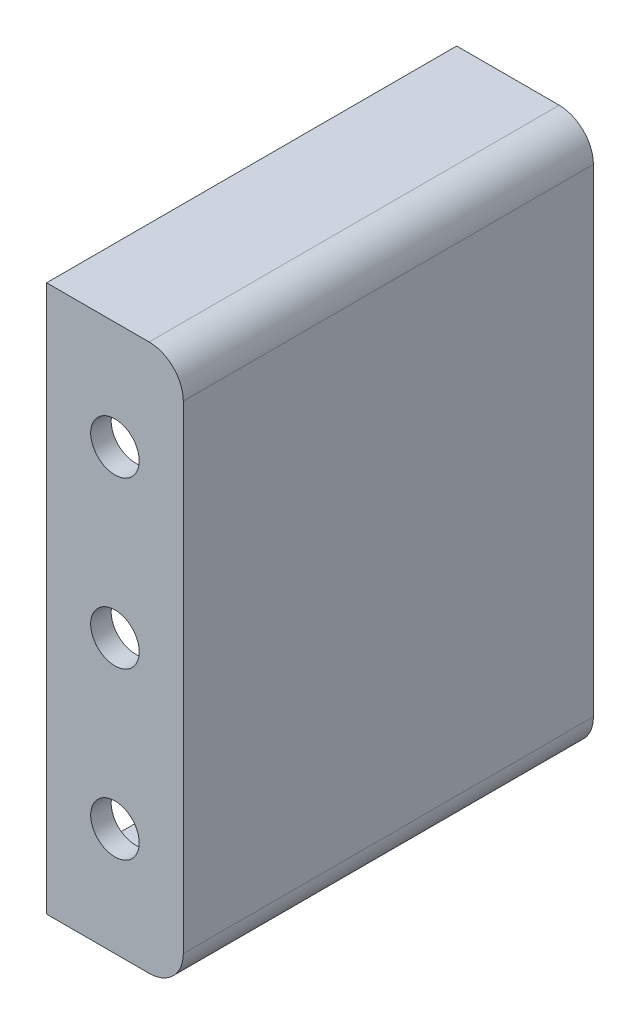
from build123d import *

# Parameters (mm, degrees)
SKETCH1_W                                   = 80
SKETCH1_H                                   = 20
BOSS_EXTRUDE1_DEPTH                         = 60
F_2_MM_TOP_BOT_3_MM_SIDE_T                  = -3
F_2_MM_TOP_BOT_3_MM_SIDE_THICKNESS_3_FACE_W = 54
F_2_MM_TOP_BOT_3_MM_SIDE_THICKNESS_3_FACE_H = 17
F_2_MM_TOP_BOT_3_MM_SIDE_THICKNESS_3_DEPTH  = 2
CUT_EXTRUDE1_DEPTH                          = 3
SKETCH4_R                                   = 3.55
CUT_EXTRUDE3_DEPTH                          = 10
F_5_MM_RADIUS_R                             = 5
F_8_5_START                                 = -2
SKETCH7_R                                   = 4.25
F_8_5_MM_HOLD_OFFSET_2_MM_DEPTH             = 3.2


with BuildPart() as part:
    # Sketch1 → Boss-Extrude1 (new body)
    with BuildSketch(Plane(origin=(0, 0, 0), x_dir=(0, 1, 0), z_dir=(0, 0, 1))):
        Rectangle(SKETCH1_W, SKETCH1_H)
    extrude(amount=BOSS_EXTRUDE1_DEPTH)

    # 2 mm top/bot 3 mm side
    f_2_mm_top_bot_3_mm_side_openings = [part.faces().sort_by_distance(p)[0] for p in [
        (-10, 0, 30),
    ]]
    offset(amount=F_2_MM_TOP_BOT_3_MM_SIDE_T, openings=f_2_mm_top_bot_3_mm_side_openings, kind=Kind.INTERSECTION)

    # 2 mm top/bot 3 mm side thickness 3 face (on inner face of the shell) → 2 mm top/bot 3 mm side thickness 3 (add)
    with BuildSketch(Plane(origin=(-1.5, -37, 30), x_dir=(0, 0, -1), z_dir=(0, -1, 0))):
        Rectangle(F_2_MM_TOP_BOT_3_MM_SIDE_THICKNESS_3_FACE_W, F_2_MM_TOP_BOT_3_MM_SIDE_THICKNESS_3_FACE_H)
    extrude(amount=-F_2_MM_TOP_BOT_3_MM_SIDE_THICKNESS_3_DEPTH)

    # Sketch3 → Cut-Extrude1 (cut)
    with BuildSketch(Plane(origin=(0, 0, 0), x_dir=(1, 0, 0), z_dir=(0, 0, -1))):
        with BuildLine():
            ThreePointArc((4.9, 22.5), (3.464823228, 25.964823228), (0, 27.4))
            Line((0, 27.4), (0, 17.6))
            ThreePointArc((0, 17.6), (3.464823228, 19.035176772), (4.9, 22.5))
        make_face()
        with BuildLine():
            Line((0, 17.6), (0, 27.4))
            ThreePointArc((0, 27.4), (-4.9, 22.5), (0, 17.6))
        make_face()
        with BuildLine():
            ThreePointArc((4.9, 7.5), (3.464823228, 10.964823228), (0, 12.4))
            Line((0, 12.4), (0, 2.6))
            ThreePointArc((0, 2.6), (3.464823228, 4.035176772), (4.9, 7.5))
        make_face()
        with BuildLine():
            Line((0, 2.6), (0, 12.4))
            ThreePointArc((0, 12.4), (-4.9, 7.5), (0, 2.6))
        make_face()
        with BuildLine():
            ThreePointArc((4.9, -7.5), (3.464823228, -4.035176772), (0, -2.6))
            Line((0, -2.6), (0, -12.4))
            ThreePointArc((0, -12.4), (3.464823228, -10.964823228), (4.9, -7.5))
        make_face()
        with BuildLine():
            Line((0, -12.4), (0, -2.6))
            ThreePointArc((0, -2.6), (-4.9, -7.5), (0, -12.4))
        make_face()
        with BuildLine():
            ThreePointArc((4.9, -22.5), (3.464823228, -19.035176772), (0, -17.6))
            Line((0, -17.6), (0, -27.4))
            ThreePointArc((0, -27.4), (3.464823228, -25.964823228), (4.9, -22.5))
        make_face()
        with BuildLine():
            Line((0, -27.4), (0, -17.6))
            ThreePointArc((0, -17.6), (-4.9, -22.5), (0, -27.4))
        make_face()
    extrude(amount=-CUT_EXTRUDE1_DEPTH, mode=Mode.SUBTRACT)

    # Sketch4 → Cut-Extrude3 (cut)
    with BuildSketch(Plane.XY.offset(60)):
        with Locations((0, 24.2)):
            Circle(SKETCH4_R)
        Circle(SKETCH4_R)
        with Locations((0, -24.2)):
            Circle(SKETCH4_R)
    extrude(amount=-CUT_EXTRUDE3_DEPTH, mode=Mode.SUBTRACT)

    # 5 mm radius
    f_5_mm_radius_edges = [part.edges().sort_by_distance(p)[0] for p in [
        (7, -35, 30),
        (7, 37, 30),
        (10, -40, 30),
        (10, 40, 30),
    ]]
    fillet(f_5_mm_radius_edges, radius=F_5_MM_RADIUS_R)

    # Sketch7 → 8.5 mm hold offset 2 mm (cut)
    with BuildSketch(Plane(origin=(0, 40, 0), x_dir=(-1, 0, 0), z_dir=(0, 1, 0)).offset(F_8_5_START)):
        with Locations(Location((2.5, 30, 0), (0, 0, 90))):
            Circle(SKETCH7_R)
    f_8_5_mm_hold_offset_2_mm = extrude(amount=-F_8_5_MM_HOLD_OFFSET_2_MM_DEPTH, mode=Mode.SUBTRACT)

    # Mirror1: 8.5 mm hold offset 2 mm across plane
    add(f_8_5_mm_hold_offset_2_mm.mirror(Plane.ZX), mode=Mode.SUBTRACT)


solid = part.part
